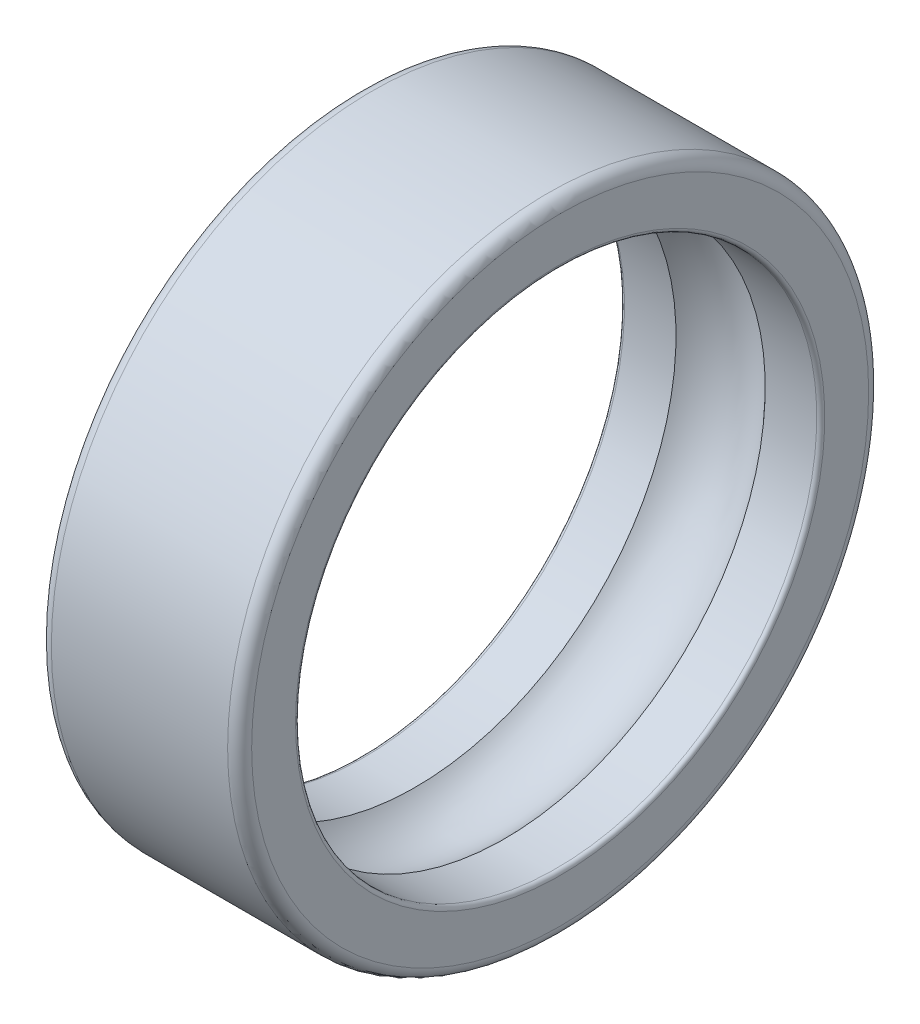
from build123d import *


with BuildPart() as part:
    # Esquisse1 → Révolution1 (revolve)
    with BuildSketch(Plane.XY, mode=Mode.PRIVATE) as r_volution1_sk:
        with BuildLine():
            Line((0, 15.4), (0, 13.21))
            ThreePointArc((0, 13.21), (0.058578644, 13.068578644), (0.2, 13.01))
            Line((0.2, 13.01), (2.772916706, 13.01))
            ThreePointArc((2.772916706, 13.01), (5, 14), (7.227083294, 13.01))
            Line((7.227083294, 13.01), (9.8, 13.01))
            ThreePointArc((9.8, 13.01), (9.941421356, 13.068578644), (10, 13.21))
            Line((10, 13.21), (10, 15.4))
            ThreePointArc((10, 15.4), (9.824264069, 15.824264069), (9.4, 16))
            Line((9.4, 16), (0.6, 16))
            ThreePointArc((0.6, 16), (0.175735931, 15.824264069), (0, 15.4))
        make_face()
    revolve(r_volution1_sk.sketch.rotate(Axis((50, 0, 0), (-1, 0, 0)), 270), axis=Axis((50, 0, 0), (-1, 0, 0)))


solid = part.part
